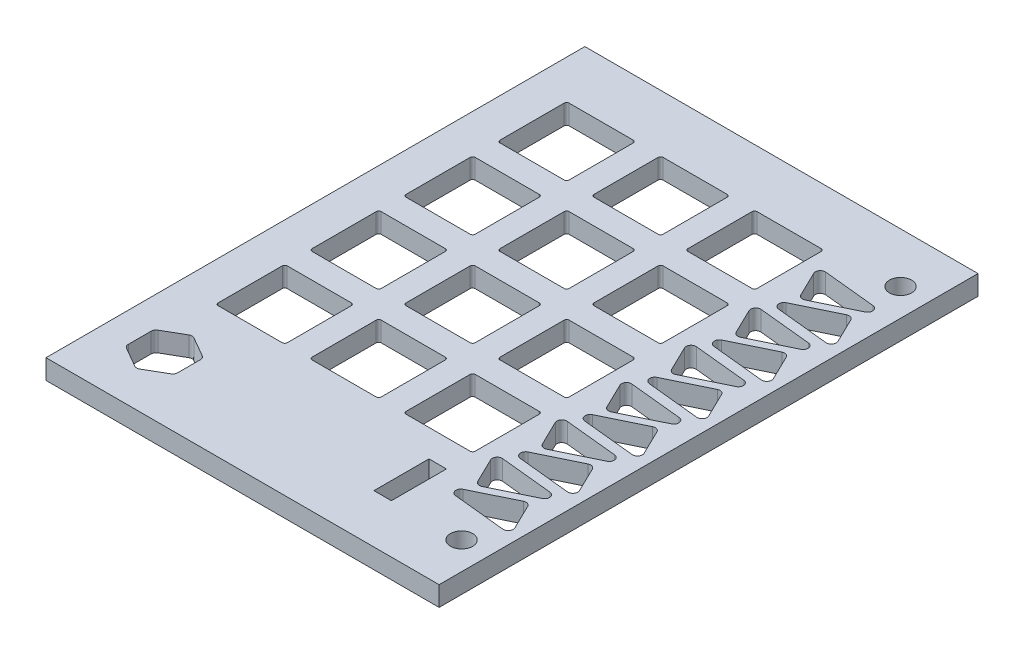
from build123d import *

# Parameters (mm, degrees)
SCHIZZO1_W                   = 88.702342
SCHIZZO1_H                   = 109.25
ESTRUSIONE_ESTRUSIONE1_DEPTH = 4
TAGLIO_ESTRUSIONE1_DEPTH     = 20
SCHIZZO3_R                   = 2.25
TAGLIO_ESTRUSIONE2_DEPTH     = 10
TAGLIO_ESTRUSIONE3_DEPTH     = 10
RACCORDO1_R                  = 1
SCHIZZO5_W                   = 9
SCHIZZO5_H                   = 109.25
TAGLIO_ESTRUSIONE4_DEPTH     = 10
SCHIZZO7_W                   = 3.54
SCHIZZO7_H                   = 11.16
TAGLIO_ESTRUSIONE5_DEPTH     = 12.7
TAGLIO_ESTRUSIONE6_DEPTH     = 10
RACCORDO2_R                  = 1


with BuildPart() as part:
    # Schizzo1 → Estrusione-Estrusione1 (new body)
    with BuildSketch(Plane(origin=(0, 0, 0), x_dir=(1, 0, 0), z_dir=(0, 1, 0))):
        with Locations((-1.523829, 0)):
            Rectangle(SCHIZZO1_W, SCHIZZO1_H)
    extrude(amount=ESTRUSIONE_ESTRUSIONE1_DEPTH)

    # Schizzo2 → Taglio-Estrusione1 (cut)
    with BuildSketch(Plane.XZ):
        with BuildLine():
            Line((-15.55, 28.05), (-28.55, 28.05))
            ThreePointArc((-28.55, 28.05), (-28.903553391, 27.903553391), (-29.05, 27.55))
            Line((-29.05, 27.55), (-29.05, 14.55))
            ThreePointArc((-29.05, 14.55), (-28.903553391, 14.196446609), (-28.55, 14.05))
            Line((-28.55, 14.05), (-15.55, 14.05))
            ThreePointArc((-15.55, 14.05), (-15.196446609, 14.196446609), (-15.05, 14.55))
            Line((-15.05, 14.55), (-15.05, 27.55))
            ThreePointArc((-15.05, 27.55), (-15.196446609, 27.903553391), (-15.55, 28.05))
        make_face()
        with BuildLine():
            Line((3.5, 28.05), (-9.5, 28.05))
            ThreePointArc((-9.5, 28.05), (-9.853553391, 27.903553391), (-10, 27.55))
            Line((-10, 27.55), (-10, 14.55))
            ThreePointArc((-10, 14.55), (-9.853553391, 14.196446609), (-9.5, 14.05))
            Line((-9.5, 14.05), (3.5, 14.05))
            ThreePointArc((3.5, 14.05), (3.853553391, 14.196446609), (4, 14.55))
            Line((4, 14.55), (4, 27.55))
            ThreePointArc((4, 27.55), (3.853553391, 27.903553391), (3.5, 28.05))
        make_face()
        with BuildLine():
            Line((22.55, 28.05), (9.55, 28.05))
            ThreePointArc((9.55, 28.05), (9.196446609, 27.903553391), (9.05, 27.55))
            Line((9.05, 27.55), (9.05, 14.55))
            ThreePointArc((9.05, 14.55), (9.196446609, 14.196446609), (9.55, 14.05))
            Line((9.55, 14.05), (22.55, 14.05))
            ThreePointArc((22.55, 14.05), (22.903553391, 14.196446609), (23.05, 14.55))
            Line((23.05, 14.55), (23.05, 27.55))
            ThreePointArc((23.05, 27.55), (22.903553391, 27.903553391), (22.55, 28.05))
        make_face()
        with BuildLine():
            Line((-15.55, 9), (-28.55, 9))
            ThreePointArc((-28.55, 9), (-28.903553391, 8.853553391), (-29.05, 8.5))
            Line((-29.05, 8.5), (-29.05, -4.5))
            ThreePointArc((-29.05, -4.5), (-28.903553391, -4.853553391), (-28.55, -5))
            Line((-28.55, -5), (-15.55, -5))
            ThreePointArc((-15.55, -5), (-15.196446609, -4.853553391), (-15.05, -4.5))
            Line((-15.05, -4.5), (-15.05, 8.5))
            ThreePointArc((-15.05, 8.5), (-15.196446609, 8.853553391), (-15.55, 9))
        make_face()
        with BuildLine():
            Line((3.5, 9), (-9.5, 9))
            ThreePointArc((-9.5, 9), (-9.853553391, 8.853553391), (-10, 8.5))
            Line((-10, 8.5), (-10, -4.5))
            ThreePointArc((-10, -4.5), (-9.853553391, -4.853553391), (-9.5, -5))
            Line((-9.5, -5), (3.5, -5))
            ThreePointArc((3.5, -5), (3.853553391, -4.853553391), (4, -4.5))
            Line((4, -4.5), (4, 8.5))
            ThreePointArc((4, 8.5), (3.853553391, 8.853553391), (3.5, 9))
        make_face()
        with BuildLine():
            Line((22.55, 9), (9.55, 9))
            ThreePointArc((9.55, 9), (9.196446609, 8.853553391), (9.05, 8.5))
            Line((9.05, 8.5), (9.05, -4.5))
            ThreePointArc((9.05, -4.5), (9.196446609, -4.853553391), (9.55, -5))
            Line((9.55, -5), (22.55, -5))
            ThreePointArc((22.55, -5), (22.903553391, -4.853553391), (23.05, -4.5))
            Line((23.05, -4.5), (23.05, 8.5))
            ThreePointArc((23.05, 8.5), (22.903553391, 8.853553391), (22.55, 9))
        make_face()
        with BuildLine():
            Line((-15.55, -10.05), (-28.55, -10.05))
            ThreePointArc((-28.55, -10.05), (-28.903553391, -10.196446609), (-29.05, -10.55))
            Line((-29.05, -10.55), (-29.05, -23.55))
            ThreePointArc((-29.05, -23.55), (-28.903553391, -23.903553391), (-28.55, -24.05))
            Line((-28.55, -24.05), (-15.55, -24.05))
            ThreePointArc((-15.55, -24.05), (-15.196446609, -23.903553391), (-15.05, -23.55))
            Line((-15.05, -23.55), (-15.05, -10.55))
            ThreePointArc((-15.05, -10.55), (-15.196446609, -10.196446609), (-15.55, -10.05))
        make_face()
        with BuildLine():
            Line((3.5, -10.05), (-9.5, -10.05))
            ThreePointArc((-9.5, -10.05), (-9.853553391, -10.196446609), (-10, -10.55))
            Line((-10, -10.55), (-10, -23.55))
            ThreePointArc((-10, -23.55), (-9.853553391, -23.903553391), (-9.5, -24.05))
            Line((-9.5, -24.05), (3.5, -24.05))
            ThreePointArc((3.5, -24.05), (3.853553391, -23.903553391), (4, -23.55))
            Line((4, -23.55), (4, -10.55))
            ThreePointArc((4, -10.55), (3.853553391, -10.196446609), (3.5, -10.05))
        make_face()
        with BuildLine():
            Line((22.55, -10.05), (9.55, -10.05))
            ThreePointArc((9.55, -10.05), (9.196446609, -10.196446609), (9.05, -10.55))
            Line((9.05, -10.55), (9.05, -23.55))
            ThreePointArc((9.05, -23.55), (9.196446609, -23.903553391), (9.55, -24.05))
            Line((9.55, -24.05), (22.55, -24.05))
            ThreePointArc((22.55, -24.05), (22.903553391, -23.903553391), (23.05, -23.55))
            Line((23.05, -23.55), (23.05, -10.55))
            ThreePointArc((23.05, -10.55), (22.903553391, -10.196446609), (22.55, -10.05))
        make_face()
        with BuildLine():
            Line((-15.55, -29.1), (-28.55, -29.1))
            ThreePointArc((-28.55, -29.1), (-28.903553391, -29.246446609), (-29.05, -29.6))
            Line((-29.05, -29.6), (-29.05, -42.6))
            ThreePointArc((-29.05, -42.6), (-28.903553391, -42.953553391), (-28.55, -43.1))
            Line((-28.55, -43.1), (-15.55, -43.1))
            ThreePointArc((-15.55, -43.1), (-15.196446609, -42.953553391), (-15.05, -42.6))
            Line((-15.05, -42.6), (-15.05, -29.6))
            ThreePointArc((-15.05, -29.6), (-15.196446609, -29.246446609), (-15.55, -29.1))
        make_face()
        with BuildLine():
            Line((3.5, -29.1), (-9.5, -29.1))
            ThreePointArc((-9.5, -29.1), (-9.853553391, -29.246446609), (-10, -29.6))
            Line((-10, -29.6), (-10, -42.6))
            ThreePointArc((-10, -42.6), (-9.853553391, -42.953553391), (-9.5, -43.1))
            Line((-9.5, -43.1), (3.5, -43.1))
            ThreePointArc((3.5, -43.1), (3.853553391, -42.953553391), (4, -42.6))
            Line((4, -42.6), (4, -29.6))
            ThreePointArc((4, -29.6), (3.853553391, -29.246446609), (3.5, -29.1))
        make_face()
        with BuildLine():
            Line((22.55, -29.1), (9.55, -29.1))
            ThreePointArc((9.55, -29.1), (9.196446609, -29.246446609), (9.05, -29.6))
            Line((9.05, -29.6), (9.05, -42.6))
            ThreePointArc((9.05, -42.6), (9.196446609, -42.953553391), (9.55, -43.1))
            Line((9.55, -43.1), (22.55, -43.1))
            ThreePointArc((22.55, -43.1), (22.903553391, -42.953553391), (23.05, -42.6))
            Line((23.05, -42.6), (23.05, -29.6))
            ThreePointArc((23.05, -29.6), (22.903553391, -29.246446609), (22.55, -29.1))
        make_face()
    extrude(amount=-TAGLIO_ESTRUSIONE1_DEPTH, mode=Mode.SUBTRACT)

    # Schizzo3 → Taglio-Estrusione2 (cut)
    with BuildSketch(Plane.XZ):
        with Locations(Location((37.25, 44.5, 0), (0, 0, 270))):
            Circle(SCHIZZO3_R)
        with Locations(Location((37.25, -44.5, 0), (0, 0, 270))):
            Circle(SCHIZZO3_R)
    extrude(amount=-TAGLIO_ESTRUSIONE2_DEPTH, mode=Mode.SUBTRACT)

    # Schizzo4 → Taglio-Estrusione3 (cut)
    with BuildSketch(Plane.XZ):
        Polygon((25.350072985, 25.875), (41.327342, 27.503109205), (29.045467312, 33.475), align=None)
        Polygon((25.350072985, 12.775), (29.045467312, 20.375), (41.327342, 14.403109205), align=None)
        Polygon((25.350072985, 10.775), (41.327342, 12.403109205), (37.631947673, 4.803109205), align=None)
        Polygon((41.327342, 1.303109205), (29.045467312, 7.275), (25.350072985, -0.325), align=None)
        Polygon((25.350072985, -2.325), (41.327342, -0.696890795), (37.631947673, -8.296890795), align=None)
        Polygon((29.045467312, -5.825), (41.327342, -11.796890795), (25.350072985, -13.425), align=None)
        Polygon((25.350072985, -15.425), (41.327342, -13.796890795), (37.631947673, -21.396890795), align=None)
        Polygon((29.045467312, -18.925), (41.327342, -24.896890795), (25.350072985, -26.525), align=None)
        Polygon((25.350072985, -28.525), (41.327342, -26.896890795), (37.631947673, -34.496890795), align=None)
        Polygon((29.045467312, -32.025), (41.327342, -37.996890795), (25.350072985, -39.625), align=None)
        Polygon((25.350072985, 23.875), (37.631947673, 17.903109205), (41.327342, 25.503109205), align=None)
        Polygon((25.350072985, 36.975), (37.631947673, 31.003109205), (41.327342, 38.603109205), align=None)
    extrude(amount=-TAGLIO_ESTRUSIONE3_DEPTH, mode=Mode.SUBTRACT)

    # Raccordo1
    raccordo1_edges = [part.edges().sort_by_distance(p)[0] for p in [
        (25.350072985, 2, 23.875),
        (41.327342, 2, 25.503109205),
        (37.631947673, 2, 17.903109205),
        (25.350072985, 2, 36.975),
        (41.327342, 2, 38.603109205),
        (37.631947673, 2, 31.003109205),
        (25.350072985, 2, 25.875),
        (29.045467312, 2, 33.475),
        (41.327342, 2, 27.503109205),
        (37.631947673, 2, -34.496890795),
        (25.350072985, 2, -28.525),
        (41.327342, 2, -26.896890795),
        (25.350072985, 2, -39.625),
        (29.045467312, 2, -32.025),
        (41.327342, 2, -37.996890795),
        (37.631947673, 2, -21.396890795),
        (25.350072985, 2, -15.425),
        (41.327342, 2, -13.796890795),
        (25.350072985, 2, -26.525),
        (29.045467312, 2, -18.925),
        (41.327342, 2, -24.896890795),
        (37.631947673, 2, 4.803109205),
        (25.350072985, 2, 10.775),
        (41.327342, 2, 12.403109205),
        (25.350072985, 2, -13.425),
        (29.045467312, 2, -5.825),
        (41.327342, 2, -11.796890795),
        (41.327342, 2, 1.303109205),
        (25.350072985, 2, -0.325),
        (29.045467312, 2, 7.275),
        (37.631947673, 2, -8.296890795),
        (25.350072985, 2, -2.325),
        (41.327342, 2, -0.696890795),
        (41.327342, 2, 14.403109205),
        (25.350072985, 2, 12.775),
        (29.045467312, 2, 20.375),
    ]]
    fillet(raccordo1_edges, radius=RACCORDO1_R)

    # Schizzo5 → Taglio-Estrusione4 (cut)
    with BuildSketch(Plane(origin=(0, 4, 0), x_dir=(1, 0, 0), z_dir=(0, 1, 0))):
        with Locations((-41.375, 0)):
            Rectangle(SCHIZZO5_W, SCHIZZO5_H)
    extrude(amount=-TAGLIO_ESTRUSIONE4_DEPTH, mode=Mode.SUBTRACT)

    # Schizzo7 → Taglio-Estrusione5 (cut)
    with BuildSketch(Plane(origin=(0, 4, 0), x_dir=(1, 0, 0), z_dir=(0, 1, 0))):
        with Locations((21.482500011, -39.1475)):
            Rectangle(SCHIZZO7_W, SCHIZZO7_H)
    extrude(amount=-TAGLIO_ESTRUSIONE5_DEPTH, mode=Mode.SUBTRACT)

    # Schizzo8 → Taglio-Estrusione6 (cut)
    with BuildSketch(Plane(origin=(0, 4, 0), x_dir=(1, 0, 0), z_dir=(0, 1, 0))):
        Polygon((-25.875, -47.398502692), (-20.875, -44.511751346), (-20.875, -38.738248654), (-25.875, -35.851497308), (-30.875, -38.738248654), (-30.875, -44.511751346), align=None)
    extrude(amount=-TAGLIO_ESTRUSIONE6_DEPTH, mode=Mode.SUBTRACT)

    # Raccordo2
    raccordo2_edges = [part.edges().sort_by_distance(p)[0] for p in [
        (-25.875, 2, 47.398502692),
        (-30.875, 2, 44.511751346),
        (-30.875, 2, 38.738248654),
        (-25.875, 2, 35.851497308),
        (-20.875, 2, 38.738248654),
        (-20.875, 2, 44.511751346),
    ]]
    fillet(raccordo2_edges, radius=RACCORDO2_R)


solid = part.part
